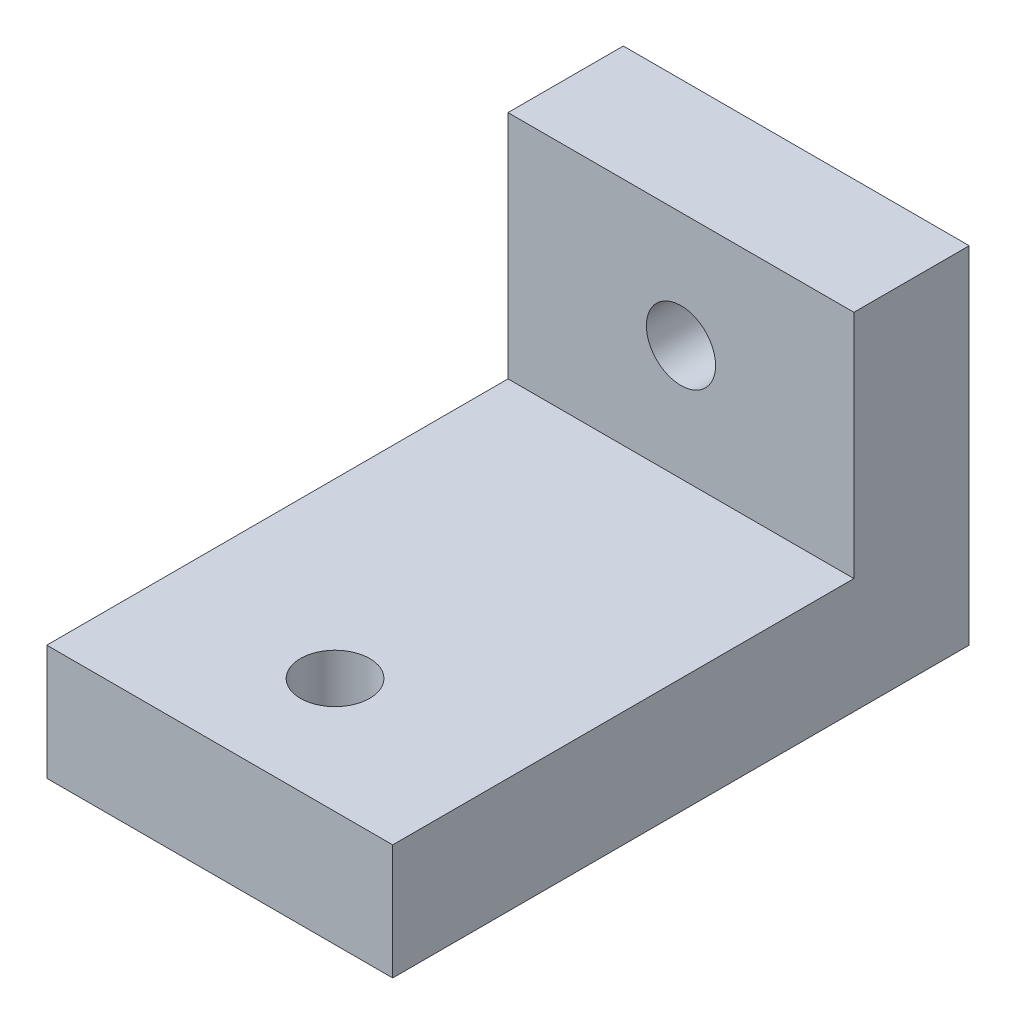
from build123d import *

# Parameters (mm, degrees)
SKETCH1_W      = 15
SKETCH1_H      = 25
EXTRUDE1_DEPTH = 5
SKETCH2_W      = 15
SKETCH2_H      = 5
EXTRUDE2_DEPTH = 10
SKETCH3_R      = 1.5
EXTRUDE3_DEPTH = 10
SKETCH4_R      = 1.5
EXTRUDE4_DEPTH = 10


with BuildPart() as part:
    # Sketch1 → Extrude1 (new body)
    with BuildSketch(Plane(origin=(0, 0, 0), x_dir=(1, 0, 0), z_dir=(0, 1, 0))):
        Rectangle(SKETCH1_W, SKETCH1_H)
    extrude(amount=EXTRUDE1_DEPTH)

    # Sketch2 → Extrude2 (add)
    with BuildSketch(Plane(origin=(0, 5, 0), x_dir=(1, 0, 0), z_dir=(0, 1, 0))):
        with Locations((0, 10)):
            Rectangle(SKETCH2_W, SKETCH2_H)
    extrude(amount=EXTRUDE2_DEPTH)

    # Sketch3 → Extrude3 (cut)
    with BuildSketch(Plane(origin=(0, 5, 0), x_dir=(1, 0, 0), z_dir=(0, 1, 0))):
        with Locations(Location((0, -7.5, 0), (0, 0, 270))):
            Circle(SKETCH3_R)
    extrude(amount=-EXTRUDE3_DEPTH, mode=Mode.SUBTRACT)

    # Sketch4 → Extrude4 (cut)
    with BuildSketch(Plane.XY.offset(-7.5)):
        with Locations((0, 10)):
            Circle(SKETCH4_R)
    extrude(amount=-EXTRUDE4_DEPTH, mode=Mode.SUBTRACT)


solid = part.part
